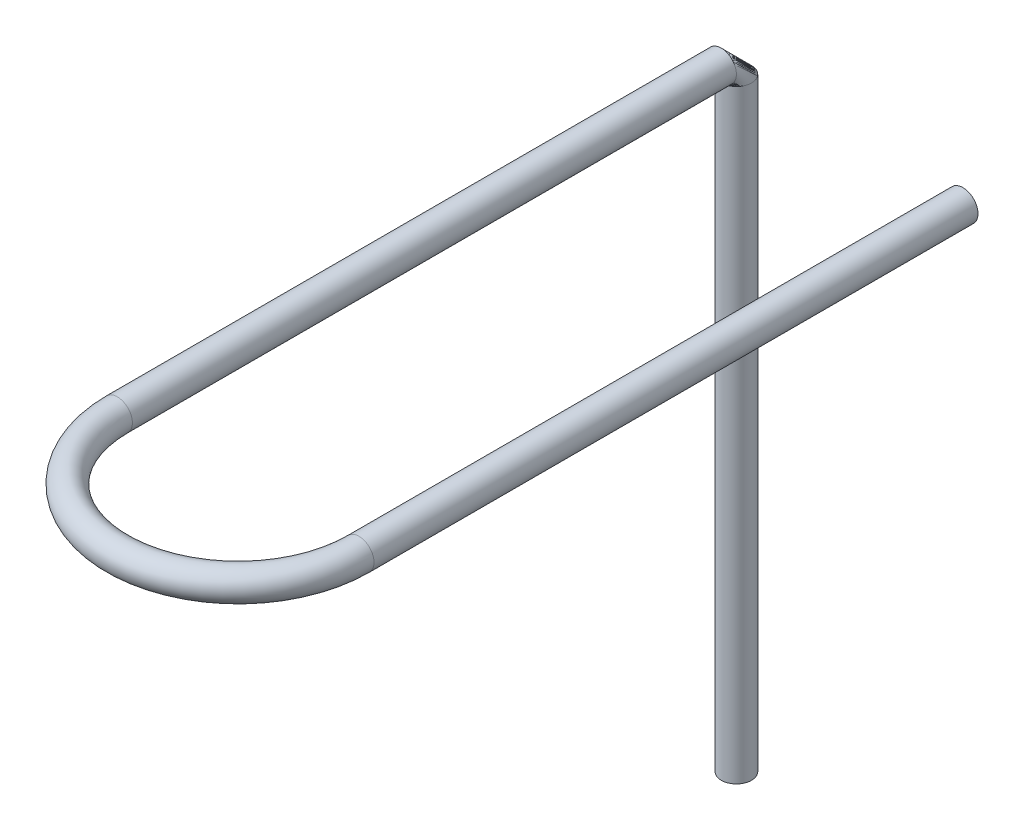
from build123d import *

# Parameters (mm, degrees)
VARREDURA2_PROFILE_R = 0.25
VARREDURA3_PROFILE_R = 0.25


with BuildPart() as part:
    # Varredura2: sweep along a path in Esboço1
    with BuildLine(Plane(origin=(0, 0, 0), x_dir=(1, 0, 0), z_dir=(0, 1, 0))) as varredura2_path:
        Line((0, 0), (0, -10))
        ThreePointArc((0, -10), (2, -12), (4, -10))
        Line((4, -10), (4, 0))
    # Varredura2 profile (on start of the path) → Varredura2 (sweep)
    with BuildSketch(Plane.XY):
        Circle(VARREDURA2_PROFILE_R)
    sweep(path=varredura2_path.line)

    # Varredura3: sweep along a path in Esboço2
    with BuildLine(Plane(origin=(0, 0, 0), x_dir=(0, 0, -1), z_dir=(1, 0, 0))) as varredura3_path:
        Line((0.25, -10.25), (0.25, -0.25))
        ThreePointArc((0.25, -0.25), (0.176776695, -0.073223305), (0, 0))
    # Varredura3 profile (on start of the path) → Varredura3 (sweep)
    with BuildSketch(Plane(origin=(0, -10.25, -0.25), x_dir=(0, 0, 1), z_dir=(0, 1, 0))):
        Circle(VARREDURA3_PROFILE_R)
    sweep(path=varredura3_path.line)


solid = part.part
